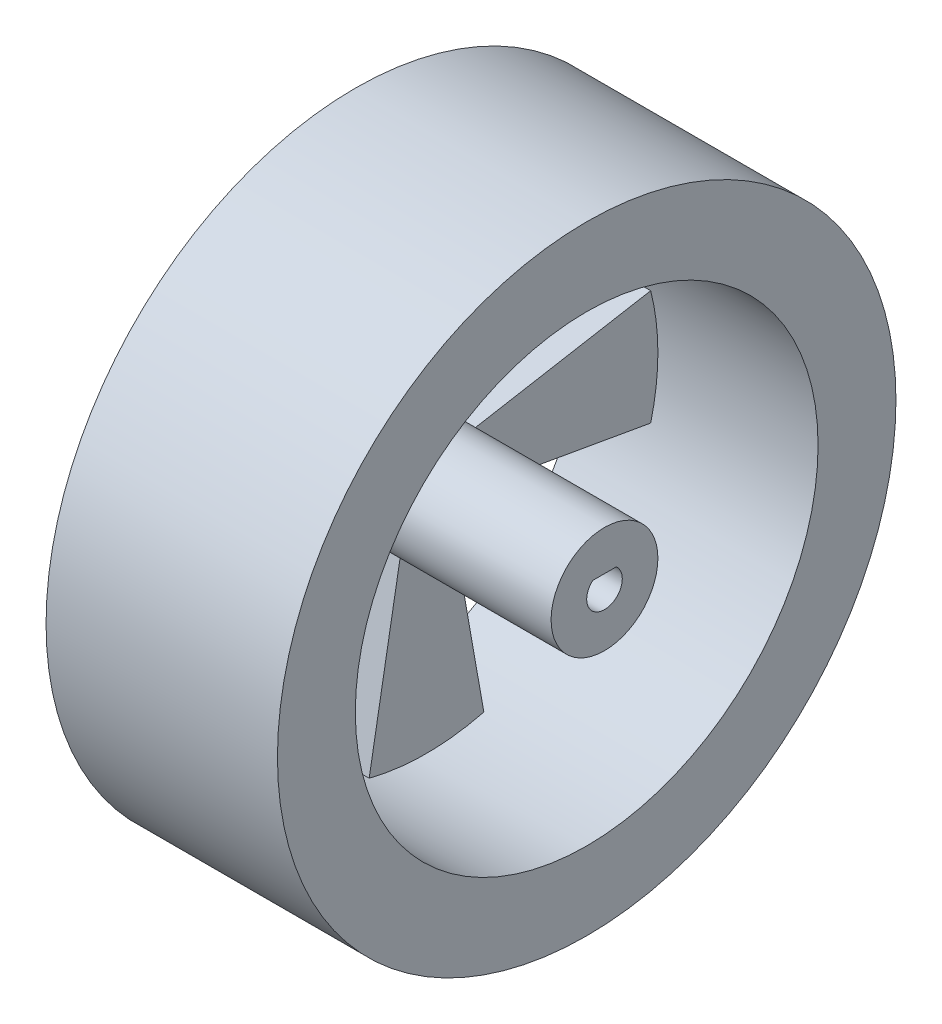
from build123d import *

# Parameters (mm, degrees)
SKETCH_1_R           = 34.75
SKETCH_1_R_2         = 26
EXTRUDE_1_DEPTH      = 26
EXTRUDE_2_DEPTH      = 3
EXTRUDE_2_DEPTH_BACK = 3
SKETCH_3_R           = 6
EXTRUDE_3_DEPTH      = 20
CUT_EXTRUDE_1_DEPTH  = 20


with BuildPart() as part:
    # 草图1 → 凸台-拉伸1 (new body)
    with BuildSketch(Plane(origin=(0, 0, 0), x_dir=(0, 0, -1), z_dir=(1, 0, 0))):
        with Locations(Location((0, 0, 0), (0, 0, 180))):
            Circle(SKETCH_1_R)
        with Locations(Location((0, 0, 0), (0, 0, 180))):
            Circle(SKETCH_1_R_2, mode=Mode.SUBTRACT)
    extrude(amount=EXTRUDE_1_DEPTH)

    # 草图2 → 凸台-拉伸2 (add, two sides: drawn at the far end of the back side and taken through both)
    with BuildSketch(Plane(origin=(5, 0, 0), x_dir=(0, 0, -1), z_dir=(1, 0, 0)).offset(-EXTRUDE_2_DEPTH_BACK)):
        with BuildLine():
            Line((-2.428148007, 2.428148007), (-6.441571828, 25.189405558))
            ThreePointArc((-6.441571828, 25.189405558), (0, 26), (6.441571828, 25.189405558))
            Line((6.441571828, 25.189405558), (2.428148007, 2.428148007))
            Line((2.428148007, 2.428148007), (25.189405558, 6.441571828))
            ThreePointArc((25.189405558, 6.441571828), (26, 0), (25.189405558, -6.441571828))
            Line((25.189405558, -6.441571828), (2.428148007, -2.428148007))
            Line((2.428148007, -2.428148007), (6.441571828, -25.189405558))
            ThreePointArc((6.441571828, -25.189405558), (0, -26), (-6.441571828, -25.189405558))
            Line((-6.441571828, -25.189405558), (-2.428148007, -2.428148007))
            Line((-2.428148007, -2.428148007), (-25.189405558, -6.441571828))
            ThreePointArc((-25.189405558, -6.441571828), (-26, 0), (-25.189405558, 6.441571828))
            Line((-25.189405558, 6.441571828), (-2.428148007, 2.428148007))
        make_face()
    extrude(amount=EXTRUDE_2_DEPTH + EXTRUDE_2_DEPTH_BACK)

    # 草图3 → 凸台-拉伸3 (add)
    with BuildSketch(Plane(origin=(8, 0, 0), x_dir=(0, 0, -1), z_dir=(1, 0, 0))):
        with Locations(Location((0, 0, 0), (0, 0, 150.836240305))):
            Circle(SKETCH_3_R)
    extrude(amount=EXTRUDE_3_DEPTH)

    # 草图4 → 切除-拉伸1 (cut)
    with BuildSketch(Plane(origin=(28, 0, 0), x_dir=(0, 0, -1), z_dir=(1, 0, 0))):
        with BuildLine():
            Line((-1.322875656, 1.5), (1.322875656, 1.5))
            ThreePointArc((1.322875656, 1.5), (0, -2), (-1.322875656, 1.5))
        make_face()
    extrude(amount=-CUT_EXTRUDE_1_DEPTH, mode=Mode.SUBTRACT)


solid = part.part
